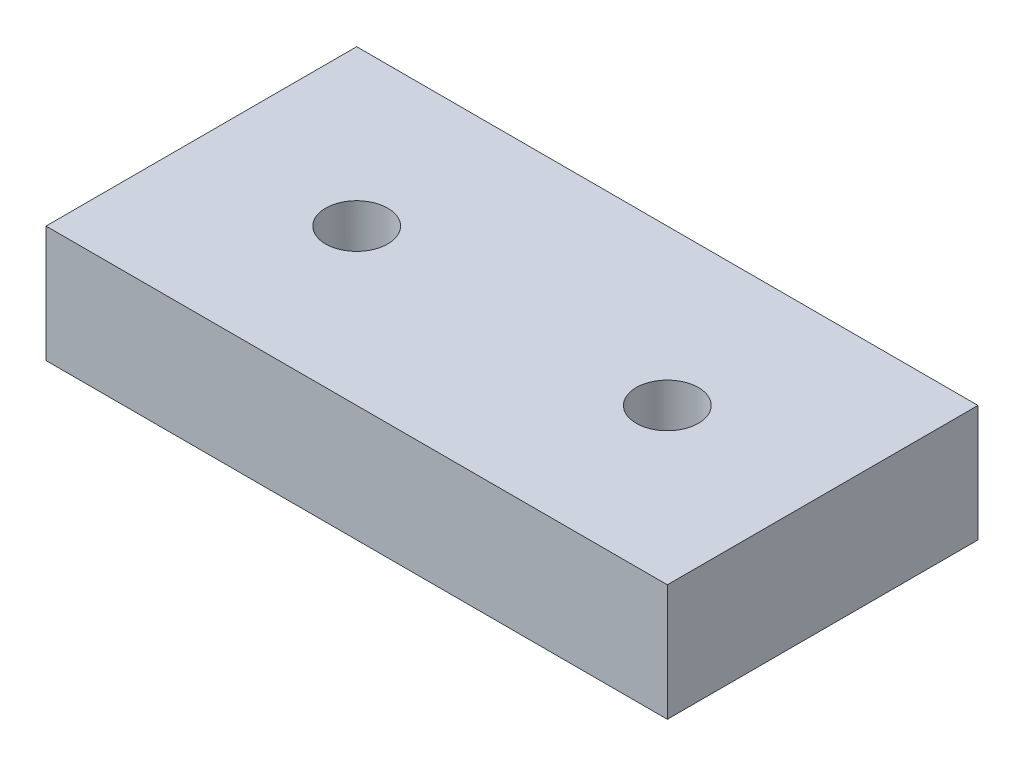
from build123d import *

# Parameters (mm, degrees)
CROQUIS1_W              = 40
CROQUIS1_H              = 20
CROQUIS1_R              = 2
SALIENTE_EXTRUIR1_DEPTH = 7.5
CROQUIS2_R              = 6
CORTAR_EXTRUIR1_DEPTH   = 4
VACIADO3_T              = -1
REDONDEO1_R             = 4


with BuildPart() as part:
    # Croquis1 → Saliente-Extruir1 (new body)
    with BuildSketch(Plane(origin=(0, 0, 0), x_dir=(1, 0, 0), z_dir=(0, 1, 0))):
        Rectangle(CROQUIS1_W, CROQUIS1_H)
        with Locations(Location((-10, 0, 0), (0, 0, 270))):
            Circle(CROQUIS1_R, mode=Mode.SUBTRACT)
        with Locations(Location((10, 0, 0), (0, 0, 270))):
            Circle(CROQUIS1_R, mode=Mode.SUBTRACT)
    extrude(amount=SALIENTE_EXTRUIR1_DEPTH)

    # Croquis2 → Cortar-Extruir1 (cut)
    with BuildSketch(Plane.XZ):
        with Locations(Location((-10, 0, 0), (0, 0, 270))):
            Circle(CROQUIS2_R)
        with Locations(Location((10, 0, 0), (0, 0, 270))):
            Circle(CROQUIS2_R)
    extrude(amount=-CORTAR_EXTRUIR1_DEPTH, mode=Mode.SUBTRACT)

    # Vaciado3
    vaciado3_openings = [part.faces().sort_by_distance(p)[0] for p in [
        (0, 0, 0),
    ]]
    offset(amount=VACIADO3_T, openings=vaciado3_openings, kind=Kind.INTERSECTION)

    # Redondeo1
    redondeo1_edges = [part.edges().sort_by_distance(p)[0] for p in [
        (-19, 3.25, -9),
        (-19, 3.25, 9),
        (19, 3.25, 9),
        (19, 3.25, -9),
    ]]
    fillet(redondeo1_edges, radius=REDONDEO1_R)


solid = part.part
